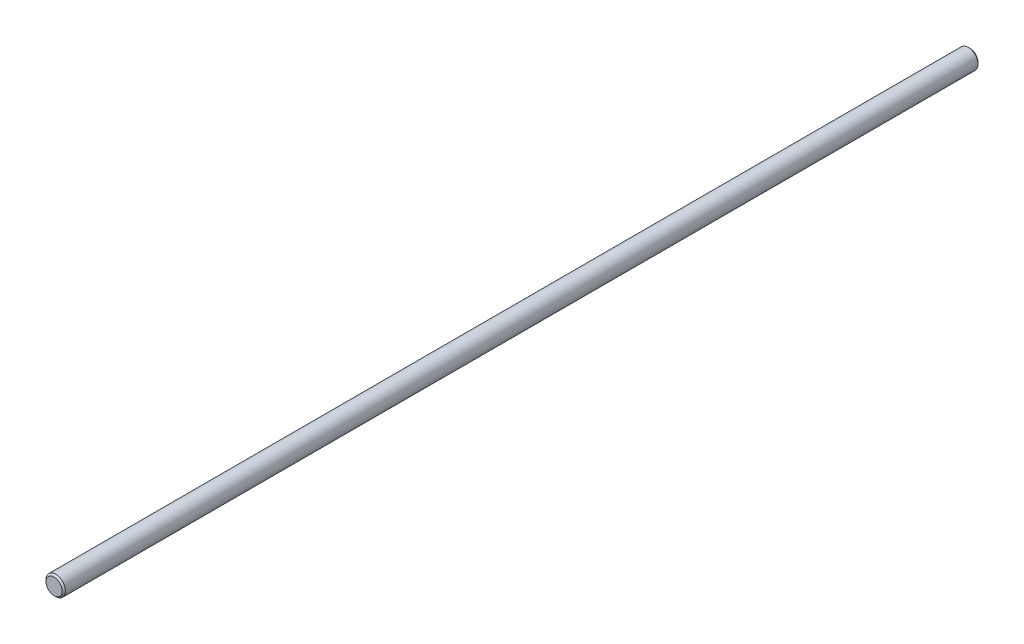
from build123d import *

# Parameters (mm, degrees)
SKETCH2_R           = 3
BOSS_EXTRUDE1_DEPTH = 141.25
CHAMFER1_SIZE       = 0.5


with BuildPart() as part:
    # Sketch2 → Boss-Extrude1 (new, symmetric)
    with BuildSketch(Plane.XY):
        Circle(SKETCH2_R)
    extrude(amount=BOSS_EXTRUDE1_DEPTH, both=True)

    # Chamfer1
    chamfer1_edges = [part.edges().sort_by_distance(p)[0] for p in [
        (-3, 0, -141.25),
        (-3, 0, 141.25),
    ]]
    chamfer(chamfer1_edges, length=CHAMFER1_SIZE)


solid = part.part
